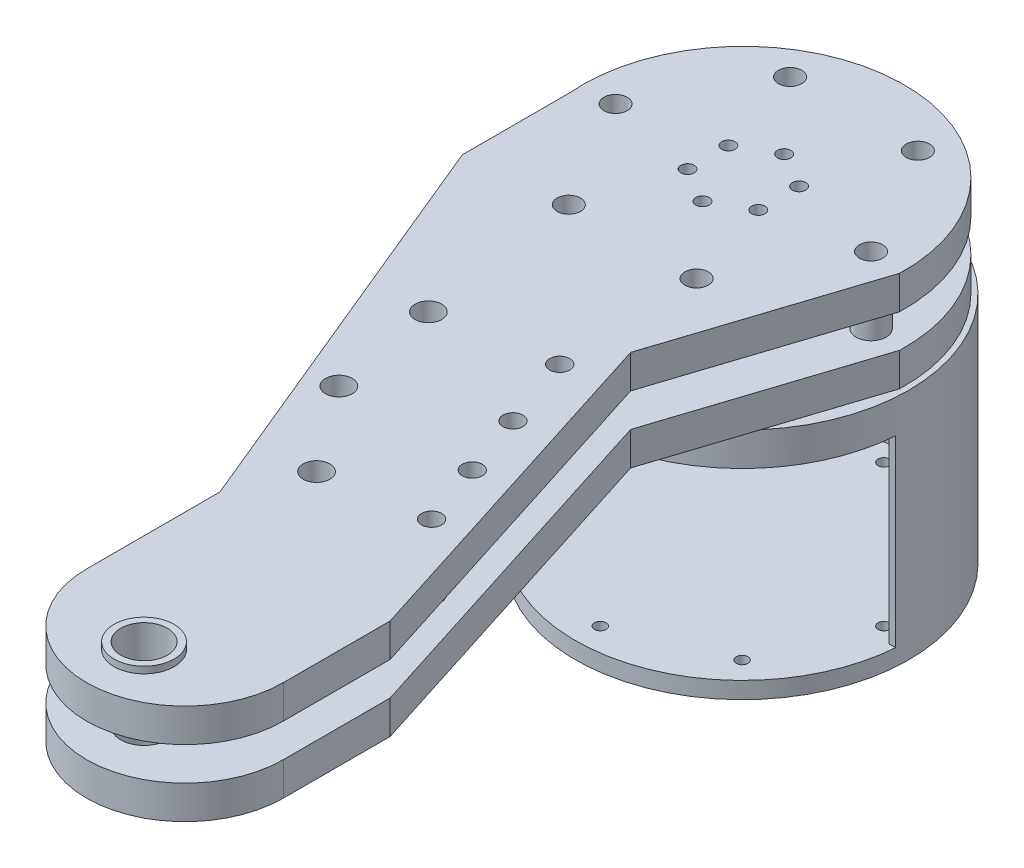
from build123d import *
from build123d.topology import SkipClean

# Parameters (mm, degrees)
EXTRUDE_4_DEPTH          = 10
SKETCH_5_R               = 2
CUT_EXTRUDE_3_DEPTH      = 252.035308536
PATTERN_CIRCULAR_1_COUNT = 6
SKETCH_6_R               = 3.5
CUT_EXTRUDE_4_DEPTH      = 252.035308536
PATTERN_CIRCULAR_2_COUNT = 6
SKETCH_7_R               = 7
CUT_EXTRUDE_6_DEPTH      = 252.035308536
SKETCH_11_R              = 4.5
EXTRUDE_5_DEPTH          = 10
PATTERN_CIRCULAR_3_COUNT = 6
SKETCH_15_R              = 10
EXTRUDE_6_DEPTH          = 10
SKETCH_26_R              = 50
EXTRUDE_10_DEPTH         = 5
SKETCH_26_5_OUTSIDE_W    = 174.739
SKETCH_26_5_OUTSIDE_H    = 341.75
SKETCH_26_5_OUTSIDE_R    = 50
SKETCH_26_5_OUTSIDE_R_2  = 2
CUT_EXTRUDE_14_DEPTH     = 5
SKETCH_27_R              = 50
EXTRUDE_11_DEPTH         = 65
CUT_EXTRUDE_START        = -5
CUT_EXTRUDE_16_DEPTH     = 55
CUT_EXTRUDE_START_2      = -60
CUT_EXTRUDE_18_DEPTH     = 55
SKETCH_31_R              = 1.75
CUT_EXTRUDE_19_DEPTH     = 5
PATTERN_CIRCULAR_4_COUNT = 8
SKETCH_32_R              = 9
SKETCH_32_R_2            = 7
EXTRUDE_12_DEPTH         = 2
SKETCH_33_R              = 3
CUT_EXTRUDE_20_DEPTH     = 271.034675795
SKETCH_34_R              = 4
CUT_EXTRUDE_21_DEPTH     = 10


with BuildPart() as part:
    # 草图2 → 凸台-拉伸4 (new body)
    with BuildSketch(Plane(origin=(0, 0, 0), x_dir=(1, 0, 0), z_dir=(0, 1, 0))):
        with BuildLine():
            Line((0, 0), (0, -32))
            Line((0, -32), (51.194707256, -155.834978697))
            Line((51.194707256, -155.834978697), (51.194707256, -195.834978697))
            ThreePointArc((51.194707256, -195.834978697), (80.694707256, -225.334978697), (110.194707256, -195.834978697))
            Line((110.194707256, -195.834978697), (110.194707256, -163.834978697))
            Line((110.194707256, -163.834978697), (76.523567349, -58.065160992))
            Line((76.523567349, -58.065160992), (96.300654989, 2.802456051))
            ThreePointArc((96.300654989, 2.802456051), (46.666363617, 52.394603419), (0, 0))
        make_face()
    extrude(amount=EXTRUDE_4_DEPTH)

    # 草图5 → 切除-拉伸3 (cut, through all)
    with BuildSketch(Plane(origin=(0, 10, 0), x_dir=(1, 0, 0), z_dir=(0, 1, 0))):
        with Locations((48.06989804, 16.403739233)):
            Circle(SKETCH_5_R)
    cut_extrude_3 = extrude(amount=-CUT_EXTRUDE_3_DEPTH, mode=Mode.SUBTRACT)

    # 阵列(圆周)1: 切除-拉伸3 ×6 about axis
    pattern_circular_1_axis = Axis((48.06989804, 10, -4.165021303), (0, -1, 0))
    for i in range(1, PATTERN_CIRCULAR_1_COUNT):
        add(cut_extrude_3.rotate(pattern_circular_1_axis, i * 360 / PATTERN_CIRCULAR_1_COUNT), mode=Mode.SUBTRACT)

    # 草图6 → 切除-拉伸4 (cut, through all)
    with BuildSketch(Plane(origin=(0, 10, 0), x_dir=(1, 0, 0), z_dir=(0, 1, 0))):
        with Locations((9.773410956, 4.165021303)):
            Circle(SKETCH_6_R)
    cut_extrude_4 = extrude(amount=-CUT_EXTRUDE_4_DEPTH, mode=Mode.SUBTRACT)

    # 阵列(圆周)2: 切除-拉伸4 ×6 about axis
    pattern_circular_2_axis = Axis((48.06989804, 10, -4.165021303), (0, -1, 0))
    for i in range(1, PATTERN_CIRCULAR_2_COUNT):
        add(cut_extrude_4.rotate(pattern_circular_2_axis, i * 360 / PATTERN_CIRCULAR_2_COUNT), mode=Mode.SUBTRACT)

    # 草图7 → 切除-拉伸6 (cut, through all)
    with BuildSketch(Plane(origin=(0, 10, 0), x_dir=(1, 0, 0), z_dir=(0, 1, 0))):
        with Locations((80.694707256, -208.084978697)):
            Circle(SKETCH_7_R)
    extrude(amount=-CUT_EXTRUDE_6_DEPTH, mode=Mode.SUBTRACT)


with BuildPart() as body_2:
    # 镜向6: mirrored copy
    add(part.part.mirror(Plane.ZX.offset(-5)))


with BuildPart() as part_1:
    add(part.part)

    add(body_2.part)  # 凸台-拉伸5 merges body 2
    # 草图11 → 凸台-拉伸5 (add, symmetric)
    with BuildSketch(Plane(origin=(0, -5, 0), x_dir=(1, 0, 0), z_dir=(0, 1, 0))):
        with Locations((9.773410956, 4.165021303)):
            Circle(SKETCH_11_R)
    extrude_5 = extrude(amount=EXTRUDE_5_DEPTH, both=True)

    # 阵列(圆周)3: 凸台-拉伸5 ×6 about axis
    pattern_circular_3_axis = Axis((48.06989804, -20, -4.165021303), (0, 1, 0))
    for i in range(1, PATTERN_CIRCULAR_3_COUNT):
        add(extrude_5.rotate(pattern_circular_3_axis, i * 360 / PATTERN_CIRCULAR_3_COUNT))

    # 草图15 → 凸台-拉伸6 (add)
    with BuildSketch(Plane(origin=(0, -10, 0), x_dir=(1, 0, 0), z_dir=(0, 1, 0))):
        with Locations((40.25784211, -76.11542009)):
            Circle(SKETCH_15_R)
        with Locations((59.742285998, -134.794304017)):
            Circle(SKETCH_15_R)
    extrude(amount=EXTRUDE_6_DEPTH)

    # 草图26 → 凸台-拉伸10 (add)
    with BuildSketch(Plane(origin=(0, -20, 0), x_dir=(-1, 0, 0), z_dir=(0, -1, 0))):
        with Locations((-48.034216366, 3.837134188)):
            Circle(SKETCH_26_R)
    extrude(amount=EXTRUDE_10_DEPTH)

    # 草图26<5> outside → 切除-拉伸14 (cut)
    # profile 1 of 7: a face of its own
    with SkipClean():  # the faces are left unmerged after this step: merging them gives an invalid solid
        with BuildSketch(Plane(origin=(0, -20, 0), x_dir=(-1, 0, 0), z_dir=(0, -1, 0))):
            with Locations((-54.1145, -85.749)):
                Rectangle(SKETCH_26_5_OUTSIDE_W, SKETCH_26_5_OUTSIDE_H)
            with Locations((-48.034216366, 3.837134188)):
                Circle(SKETCH_26_5_OUTSIDE_R, mode=Mode.SUBTRACT)
        # profile 2 of 7: a face of its own
        with BuildSketch(Plane(origin=(0, -20, 0), x_dir=(-1, 0, 0), z_dir=(0, -1, 0))):
            with Locations((-48.06989804, 16.403739233)):
                Circle(SKETCH_26_5_OUTSIDE_R_2)
        # profile 3 of 7: a face of its own
        with BuildSketch(Plane(origin=(0, -20, 0), x_dir=(-1, 0, 0), z_dir=(0, -1, 0))):
            with Locations((-37.470857403, 10.284380268)):
                Circle(SKETCH_26_5_OUTSIDE_R_2)
        # profile 4 of 7: a face of its own
        with BuildSketch(Plane(origin=(0, -20, 0), x_dir=(-1, 0, 0), z_dir=(0, -1, 0))):
            with Locations((-37.470857403, -1.954337662)):
                Circle(SKETCH_26_5_OUTSIDE_R_2)
        # profile 5 of 7: a face of its own
        with BuildSketch(Plane(origin=(0, -20, 0), x_dir=(-1, 0, 0), z_dir=(0, -1, 0))):
            with Locations((-48.06989804, -8.073696627)):
                Circle(SKETCH_26_5_OUTSIDE_R_2)
        # profile 6 of 7: a face of its own
        with BuildSketch(Plane(origin=(0, -20, 0), x_dir=(-1, 0, 0), z_dir=(0, -1, 0))):
            with Locations((-58.668938677, -1.954337662)):
                Circle(SKETCH_26_5_OUTSIDE_R_2)
        # profile 7 of 7: a face of its own
        with BuildSketch(Plane(origin=(0, -20, 0), x_dir=(-1, 0, 0), z_dir=(0, -1, 0))):
            with Locations((-58.668938677, 10.284380268)):
                Circle(SKETCH_26_5_OUTSIDE_R_2)
        extrude(amount=CUT_EXTRUDE_14_DEPTH, mode=Mode.SUBTRACT)

    # 草图27 → 凸台-拉伸11 (add)
    with SkipClean():  # the faces are left unmerged after this step: merging them gives an invalid solid
        with BuildSketch(Plane.XZ.offset(25)):
            with Locations((48.034216366, -3.837134188)):
                Circle(SKETCH_27_R)
        extrude(amount=EXTRUDE_11_DEPTH)

    # 草图30 → 切除-拉伸16 (cut)
    with SkipClean():  # the faces are left unmerged after this step: merging them gives an invalid solid
        with BuildSketch(Plane.XZ.offset(90).offset(CUT_EXTRUDE_START)):
            with BuildLine():
                Line((0, 0), (95.845046759, 0))
                ThreePointArc((95.845046759, 0), (47.922523379, -52.010409834), (0, 0))
            make_face()
        extrude(amount=-CUT_EXTRUDE_16_DEPTH, mode=Mode.SUBTRACT)

    # 草图28 → 切除-拉伸18 (cut)
    with SkipClean():  # the faces are left unmerged after this step: merging them gives an invalid solid
        with BuildSketch(Plane.XZ.offset(90).offset(CUT_EXTRUDE_START_2)):
            with BuildLine():
                Line((-1.818330221, 0), (97.886762953, 0))
                ThreePointArc((97.886762953, 0), (48.034216366, 46.162865812), (-1.818330221, 0))
            make_face()
        extrude(amount=CUT_EXTRUDE_18_DEPTH, mode=Mode.SUBTRACT)

    # 草图31 → 切除-拉伸19 (cut)
    with SkipClean():  # the faces are left unmerged after this step: merging them gives an invalid solid
        with BuildSketch(Plane(origin=(0, -90, 0), x_dir=(-1, 0, 0), z_dir=(0, -1, 0))):
            with Locations((-48.034216366, 46.337134188)):
                Circle(SKETCH_31_R)
        cut_extrude_19 = extrude(amount=-CUT_EXTRUDE_19_DEPTH, mode=Mode.SUBTRACT)

    # 阵列(圆周)4: 切除-拉伸19 ×8 about axis
    with SkipClean():  # the faces are left unmerged after this step: merging them gives an invalid solid
        pattern_circular_4_axis = Axis((48.034216366, -25, -3.837134188), (0, 1, 0))
        for i in range(1, PATTERN_CIRCULAR_4_COUNT):
            add(cut_extrude_19.rotate(pattern_circular_4_axis, i * 360 / PATTERN_CIRCULAR_4_COUNT), mode=Mode.SUBTRACT)

    # 草图32 → 凸台-拉伸12 (add)
    with SkipClean():  # the faces are left unmerged after this step: merging them gives an invalid solid
        with BuildSketch(Plane.XZ.offset(20)):
            with Locations((80.694707256, 208.084978697)):
                Circle(SKETCH_32_R)
            with Locations((80.694707256, 208.084978697)):
                Circle(SKETCH_32_R_2, mode=Mode.SUBTRACT)
        extrude_12 = extrude(amount=EXTRUDE_12_DEPTH)

    # 草图33 → 切除-拉伸20 (cut, through all)
    with BuildSketch(Plane(origin=(0, 10, 0), x_dir=(1, 0, 0), z_dir=(0, 1, 0))):
        with Locations((68.993287967, -71.793228779)):
            Circle(SKETCH_33_R)
        with Locations((76.658249851, -93.478439392)):
            Circle(SKETCH_33_R)
        with Locations((83.323434097, -112.335144272)):
            Circle(SKETCH_33_R)
        with Locations((89.988618344, -131.191849153)):
            Circle(SKETCH_33_R)
    extrude(amount=-CUT_EXTRUDE_20_DEPTH, mode=Mode.SUBTRACT)

    # 草图34 → 切除-拉伸21 (cut)
    with BuildSketch(Plane(origin=(0, 10, 0), x_dir=(1, 0, 0), z_dir=(0, 1, 0))):
        with Locations((35.681581865, -77.846678561)):
            Circle(SKETCH_34_R)
        with Locations((41.53805169, -110.53992851)):
            Circle(SKETCH_34_R)
        with Locations((60.383294084, -136.076495377)):
            Circle(SKETCH_34_R)
    cut_extrude_21 = extrude(amount=-CUT_EXTRUDE_21_DEPTH, mode=Mode.SUBTRACT)

    # 镜向7: 切除-拉伸21 across plane
    add(cut_extrude_21.mirror(Plane.ZX.offset(-5)), mode=Mode.SUBTRACT)

    # 镜向8: 凸台-拉伸12 across plane
    add(extrude_12.mirror(Plane.ZX.offset(-5)))


solid = part_1.part
